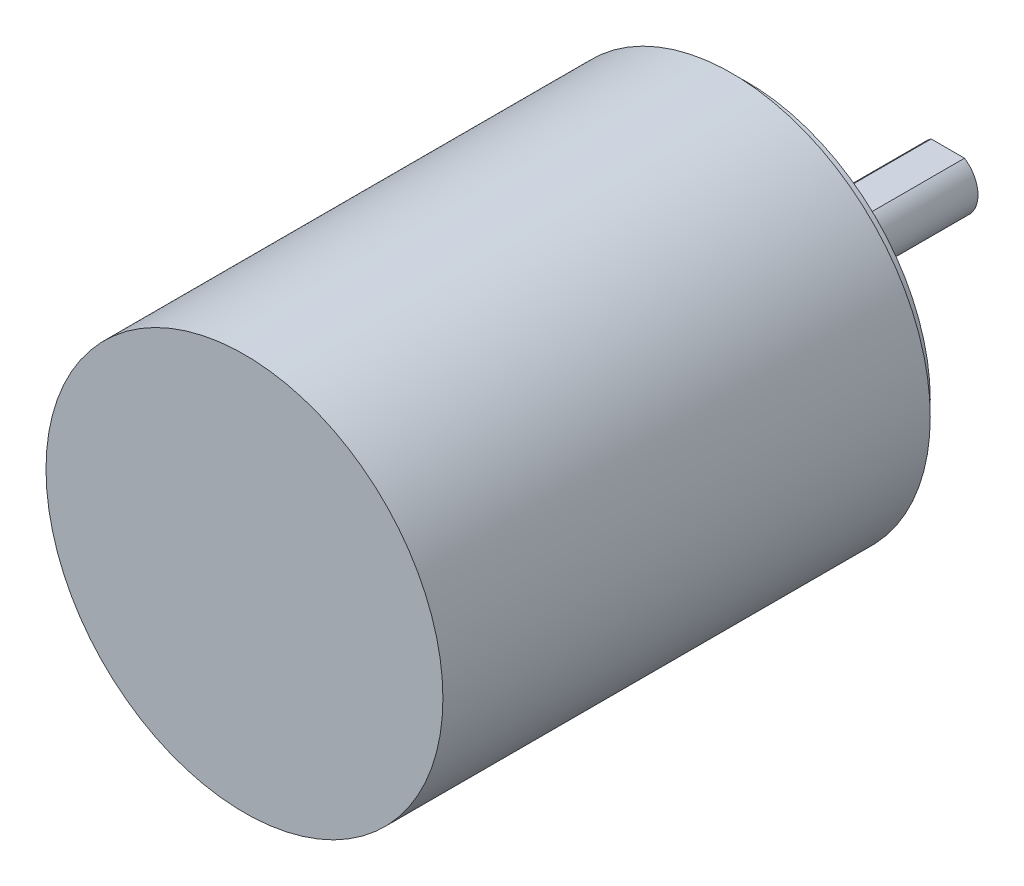
from build123d import *

# Parameters (mm, degrees)
CUT_EXTRUDE_START   = -11
SKETCH_2_W          = 16
SKETCH_2_H          = 5
CUT_EXTRUDE_4_DEPTH = 29


with BuildPart() as part:
    # 草图1 → 旋转1 (revolve)
    with BuildSketch(Plane(origin=(0, 0, 0), x_dir=(0, 0, -1), z_dir=(1, 0, 0)), mode=Mode.PRIVATE) as revolve_1_sk:
        Polygon((40, 0), (40, 6), (0, 6), (0, 36.5), (-3, 36.5), (-3, 39.5), (-100, 39.5), (-100, 0), align=None)
    revolve(revolve_1_sk.sketch.rotate(Axis((0, 0, 105), (0, 0, -1)), 90), axis=Axis((0, 0, 105), (0, 0, -1)))

    # 草图2 → 切除-拉伸4 (cut)
    with BuildSketch(Plane.XY.offset(CUT_EXTRUDE_START)):
        with Locations((0, 7.5)):
            Rectangle(SKETCH_2_W, SKETCH_2_H)
    extrude(amount=-CUT_EXTRUDE_4_DEPTH, mode=Mode.SUBTRACT)


solid = part.part
